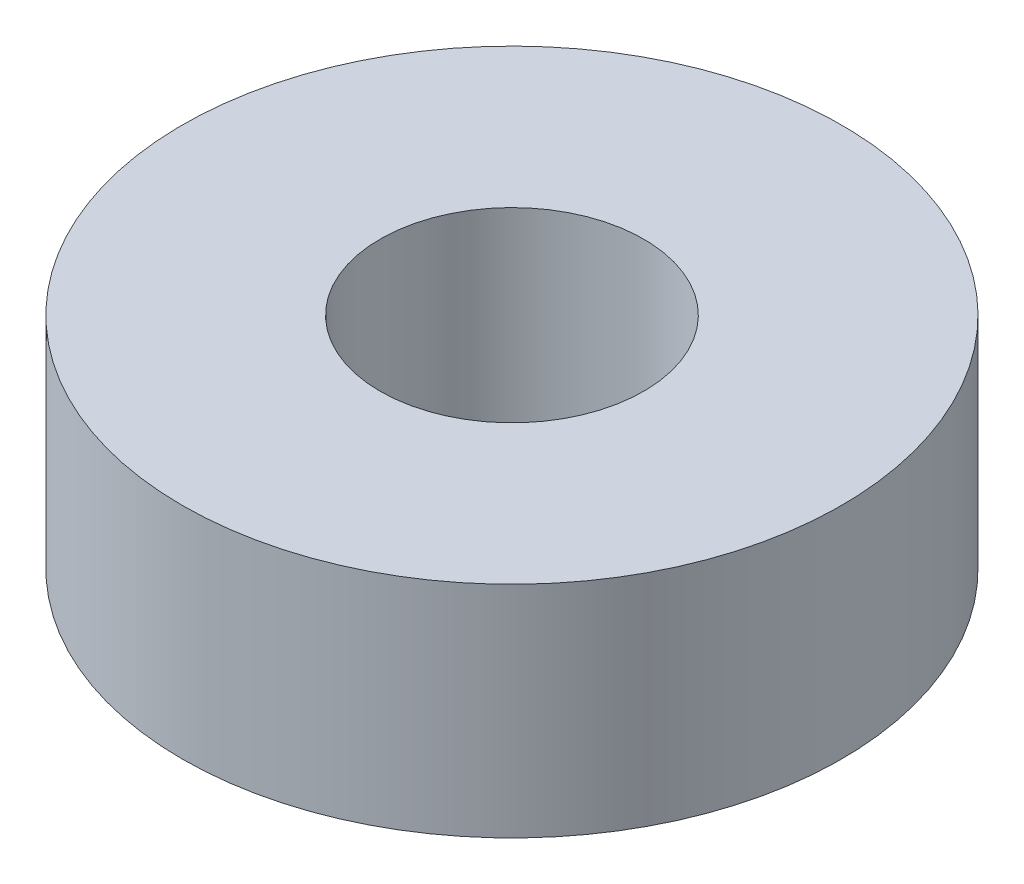
from build123d import *

# Parameters (mm, degrees)
SZKIC1_R                    = 7.5
SZKIC1_R_2                  = 3
DODANIE_WYCI_GNI_CIE1_DEPTH = 5


with BuildPart() as part:
    # Szkic1 → Dodanie-wyciągnięcie1 (new body)
    with BuildSketch(Plane(origin=(0, 0, 0), x_dir=(1, 0, 0), z_dir=(0, 1, 0))):
        with Locations(Location((0, 0, 0), (0, 0, 270))):
            Circle(SZKIC1_R)
        with Locations(Location((0, 0, 0), (0, 0, 270))):
            Circle(SZKIC1_R_2, mode=Mode.SUBTRACT)
    extrude(amount=DODANIE_WYCI_GNI_CIE1_DEPTH)


solid = part.part
